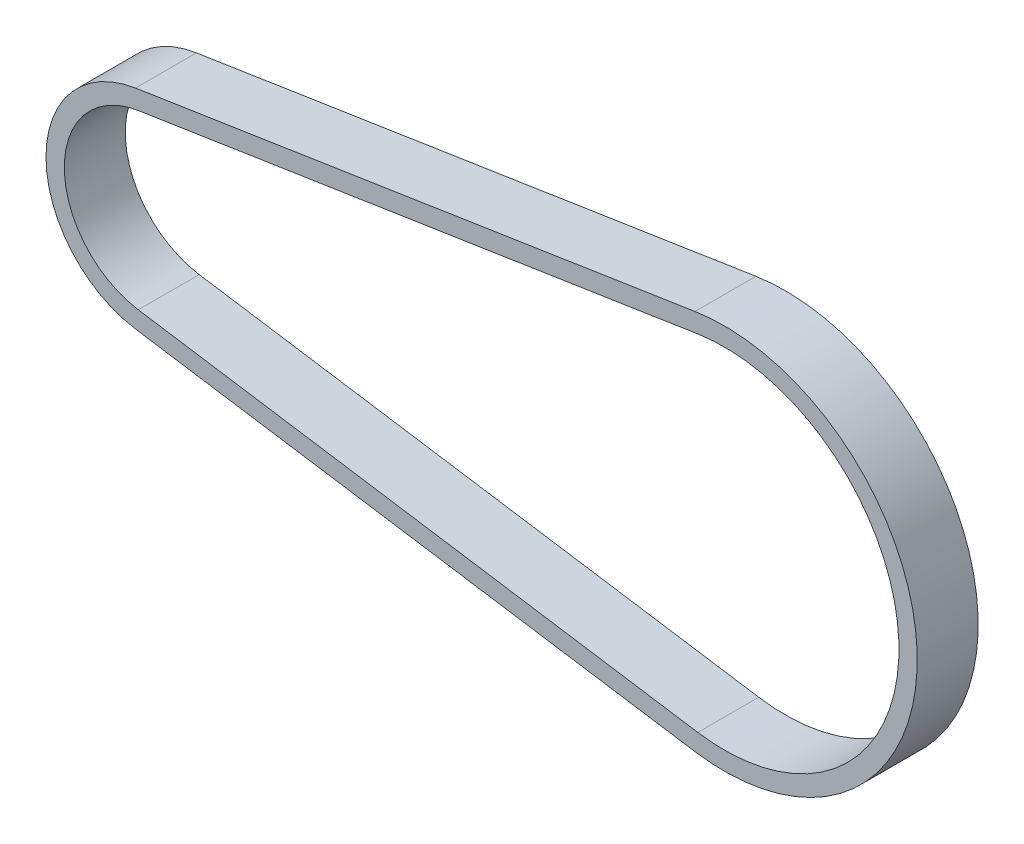
from build123d import *

# Parameters (mm, degrees)
BOSS_EXTRUDE1_DEPTH = 5


with BuildPart() as part:
    # Sketch1 → Boss-Extrude1 (new, symmetric)
    with BuildSketch(Plane.XY):
        with BuildLine():
            Line((-49.640219415, 17.122641924), (42.176742021, 31.280324207))
            ThreePointArc((42.176742021, 31.280324207), (78.65, 0), (42.176742021, -31.280324207))
            Line((42.176742021, -31.280324207), (-49.640219415, -17.122641924))
            ThreePointArc((-49.640219415, -17.122641924), (-64.325, 0), (-49.640219415, 17.122641924))
        make_face()
        with BuildLine():
            Line((-49.183038564, 14.157682283), (42.633922872, 28.315364566))
            ThreePointArc((42.633922872, 28.315364566), (75.65, 0), (42.633922872, -28.315364566))
            Line((42.633922872, -28.315364566), (-49.183038564, -14.157682283))
            ThreePointArc((-49.183038564, -14.157682283), (-61.325, 0), (-49.183038564, 14.157682283))
        make_face(mode=Mode.SUBTRACT)
    extrude(amount=BOSS_EXTRUDE1_DEPTH, both=True)


solid = part.part
